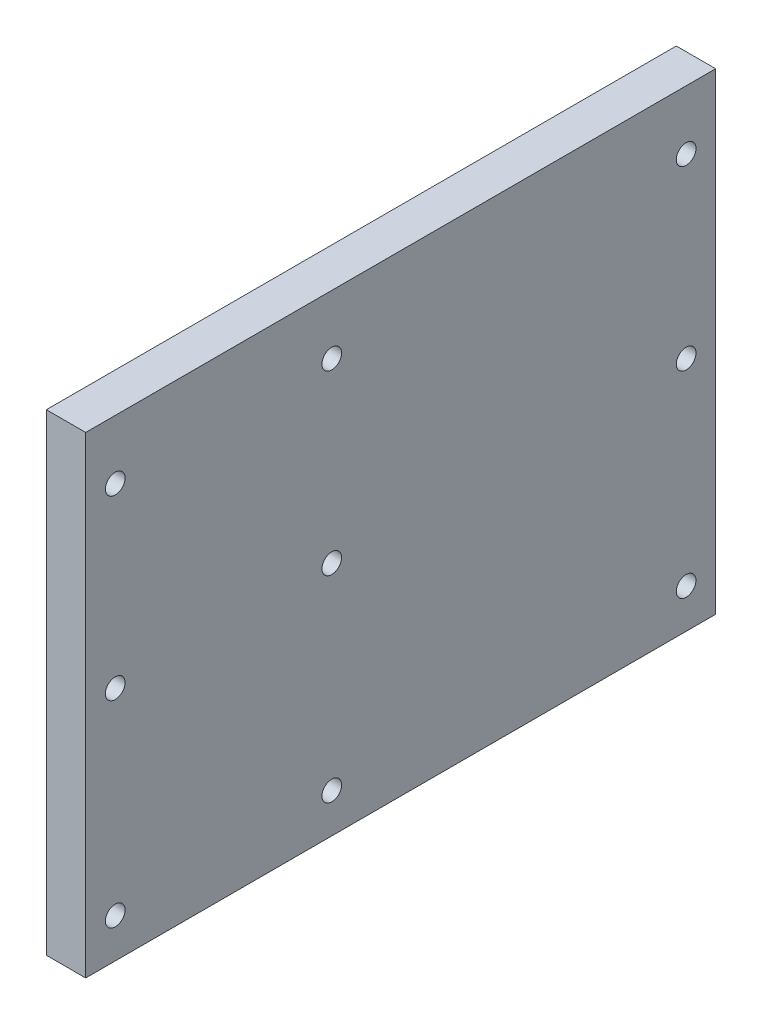
from build123d import *

# Parameters (mm, degrees)
BOSS_EXTRUDE1_DEPTH = 12.7


with BuildPart() as part:
    # Sketch1 → Boss-Extrude1 (new body)
    with BuildSketch(Plane(origin=(0, 0, 0), x_dir=(0, 0, -1), z_dir=(1, 0, 0))):
        with BuildLine():
            Line((-95.25, 0), (-101.6, 0))
            Line((-101.6, 0), (-101.6, -76.2))
            Line((-101.6, -76.2), (-92.075, -76.2))
            Line((-92.075, -76.2), (-92.075, -66.675))
            ThreePointArc((-92.075, -66.675), (-95.25, -63.5), (-92.075, -60.325))
            Line((-92.075, -60.325), (-92.075, -3.175))
            ThreePointArc((-92.075, -3.175), (-94.32006403, -2.24506403), (-95.25, 0))
        make_face()
        with BuildLine():
            Line((-92.075, 60.325), (-92.075, 76.2))
            Line((-92.075, 76.2), (-101.6, 76.2))
            Line((-101.6, 76.2), (-101.6, 0))
            Line((-101.6, 0), (-95.25, 0))
            ThreePointArc((-95.25, 0), (-94.32006403, 2.24506403), (-92.075, 3.175))
            Line((-92.075, 3.175), (-92.075, 53.975))
            ThreePointArc((-92.075, 53.975), (-95.25, 57.15), (-92.075, 60.325))
        make_face()
        with BuildLine():
            Line((-22.225, 76.2), (-92.075, 76.2))
            Line((-92.075, 76.2), (-92.075, 60.325))
            ThreePointArc((-92.075, 60.325), (-89.82993597, 59.39506403), (-88.9, 57.15))
            ThreePointArc((-88.9, 57.15), (-89.82993597, 54.90493597), (-92.075, 53.975))
            Line((-92.075, 53.975), (-92.075, 3.175))
            ThreePointArc((-92.075, 3.175), (-89.82993597, 2.24506403), (-88.9, 0))
            Line((-88.9, 0), (-25.4, 0))
            ThreePointArc((-25.4, 0), (-24.47006403, 2.24506403), (-22.225, 3.175))
            Line((-22.225, 3.175), (-22.225, 53.975))
            ThreePointArc((-22.225, 53.975), (-25.4, 57.15), (-22.225, 60.325))
            Line((-22.225, 60.325), (-22.225, 76.2))
        make_face()
        with BuildLine():
            Line((-25.4, 0), (-88.9, 0))
            ThreePointArc((-88.9, 0), (-89.82993597, -2.24506403), (-92.075, -3.175))
            Line((-92.075, -3.175), (-92.075, -60.325))
            ThreePointArc((-92.075, -60.325), (-89.82993597, -61.25493597), (-88.9, -63.5))
            ThreePointArc((-88.9, -63.5), (-89.82993597, -65.74506403), (-92.075, -66.675))
            Line((-92.075, -66.675), (-92.075, -76.2))
            Line((-92.075, -76.2), (-22.225, -76.2))
            Line((-22.225, -76.2), (-22.225, -66.675))
            ThreePointArc((-22.225, -66.675), (-25.4, -63.5), (-22.225, -60.325))
            Line((-22.225, -60.325), (-22.225, -3.175))
            ThreePointArc((-22.225, -3.175), (-24.47006403, -2.24506403), (-25.4, 0))
        make_face()
        with BuildLine():
            Line((-22.225, -66.675), (-22.225, -76.2))
            Line((-22.225, -76.2), (92.075, -76.2))
            Line((92.075, -76.2), (92.075, -66.675))
            ThreePointArc((92.075, -66.675), (88.9, -63.5), (92.075, -60.325))
            Line((92.075, -60.325), (92.075, -3.175))
            ThreePointArc((92.075, -3.175), (89.82993597, -2.24506403), (88.9, 0))
            Line((88.9, 0), (-19.05, 0))
            ThreePointArc((-19.05, 0), (-19.97993597, -2.24506403), (-22.225, -3.175))
            Line((-22.225, -3.175), (-22.225, -60.325))
            ThreePointArc((-22.225, -60.325), (-19.97993597, -61.25493597), (-19.05, -63.5))
            ThreePointArc((-19.05, -63.5), (-19.97993597, -65.74506403), (-22.225, -66.675))
        make_face()
        with BuildLine():
            Line((92.075, 76.2), (-22.225, 76.2))
            Line((-22.225, 76.2), (-22.225, 60.325))
            ThreePointArc((-22.225, 60.325), (-19.97993597, 59.39506403), (-19.05, 57.15))
            ThreePointArc((-19.05, 57.15), (-19.97993597, 54.90493597), (-22.225, 53.975))
            Line((-22.225, 53.975), (-22.225, 3.175))
            ThreePointArc((-22.225, 3.175), (-19.97993597, 2.24506403), (-19.05, 0))
            Line((-19.05, 0), (88.9, 0))
            ThreePointArc((88.9, 0), (89.82993597, 2.24506403), (92.075, 3.175))
            Line((92.075, 3.175), (92.075, 53.975))
            ThreePointArc((92.075, 53.975), (88.9, 57.15), (92.075, 60.325))
            Line((92.075, 60.325), (92.075, 76.2))
        make_face()
        with BuildLine():
            Line((101.6, 76.2), (92.075, 76.2))
            Line((92.075, 76.2), (92.075, 60.325))
            ThreePointArc((92.075, 60.325), (94.32006403, 59.39506403), (95.25, 57.15))
            ThreePointArc((95.25, 57.15), (94.32006403, 54.90493597), (92.075, 53.975))
            Line((92.075, 53.975), (92.075, 3.175))
            ThreePointArc((92.075, 3.175), (94.32006403, 2.24506403), (95.25, 0))
            Line((95.25, 0), (101.6, 0))
            Line((101.6, 0), (101.6, 76.2))
        make_face()
        with BuildLine():
            Line((101.6, -76.2), (101.6, 0))
            Line((101.6, 0), (95.25, 0))
            ThreePointArc((95.25, 0), (94.32006403, -2.24506403), (92.075, -3.175))
            Line((92.075, -3.175), (92.075, -60.325))
            ThreePointArc((92.075, -60.325), (94.32006403, -61.25493597), (95.25, -63.5))
            ThreePointArc((95.25, -63.5), (94.32006403, -65.74506403), (92.075, -66.675))
            Line((92.075, -66.675), (92.075, -76.2))
            Line((92.075, -76.2), (101.6, -76.2))
        make_face()
    extrude(amount=BOSS_EXTRUDE1_DEPTH)


solid = part.part
